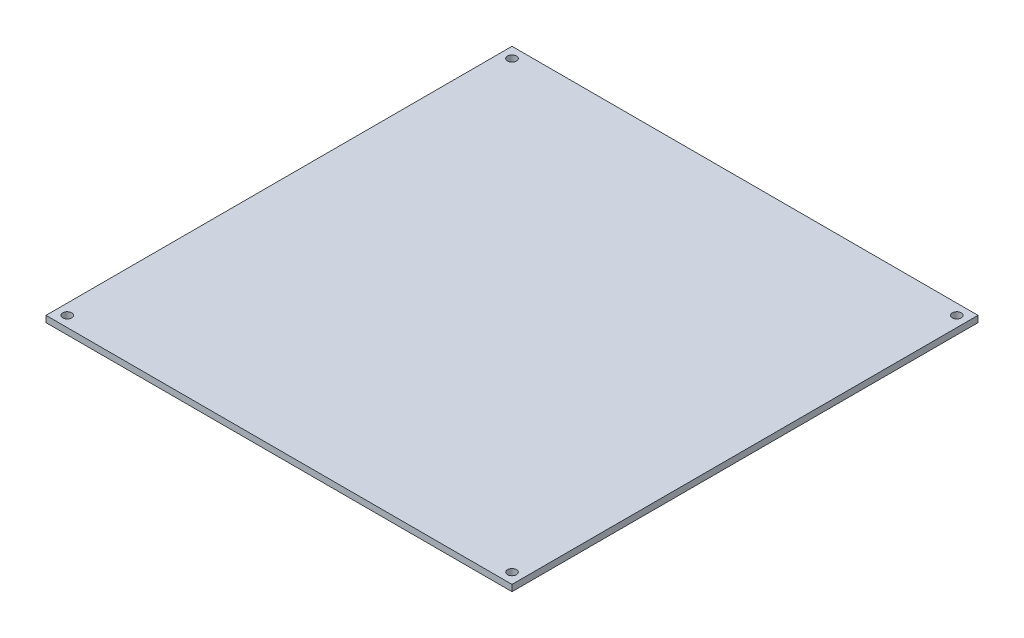
from build123d import *

# Parameters (mm, degrees)
SKETCH1_W           = 220
SKETCH1_H           = 220
SKETCH1_R           = 2.100025747
BOSS_EXTRUDE1_DEPTH = 3


with BuildPart() as part:
    # Sketch1 → Boss-Extrude1 (new body)
    with BuildSketch(Plane(origin=(0, 0, 0), x_dir=(1, 0, 0), z_dir=(0, 1, 0))):
        Rectangle(SKETCH1_W, SKETCH1_H)
        with Locations(Location((-105, 105, 0), (0, 0, 270))):
            Circle(SKETCH1_R, mode=Mode.SUBTRACT)
        with Locations(Location((105, 105, 0), (0, 0, 270))):
            Circle(SKETCH1_R, mode=Mode.SUBTRACT)
        with Locations(Location((105, -105, 0), (0, 0, 270))):
            Circle(SKETCH1_R, mode=Mode.SUBTRACT)
        with Locations(Location((-105, -105, 0), (0, 0, 270))):
            Circle(SKETCH1_R, mode=Mode.SUBTRACT)
    extrude(amount=BOSS_EXTRUDE1_DEPTH)


solid = part.part
